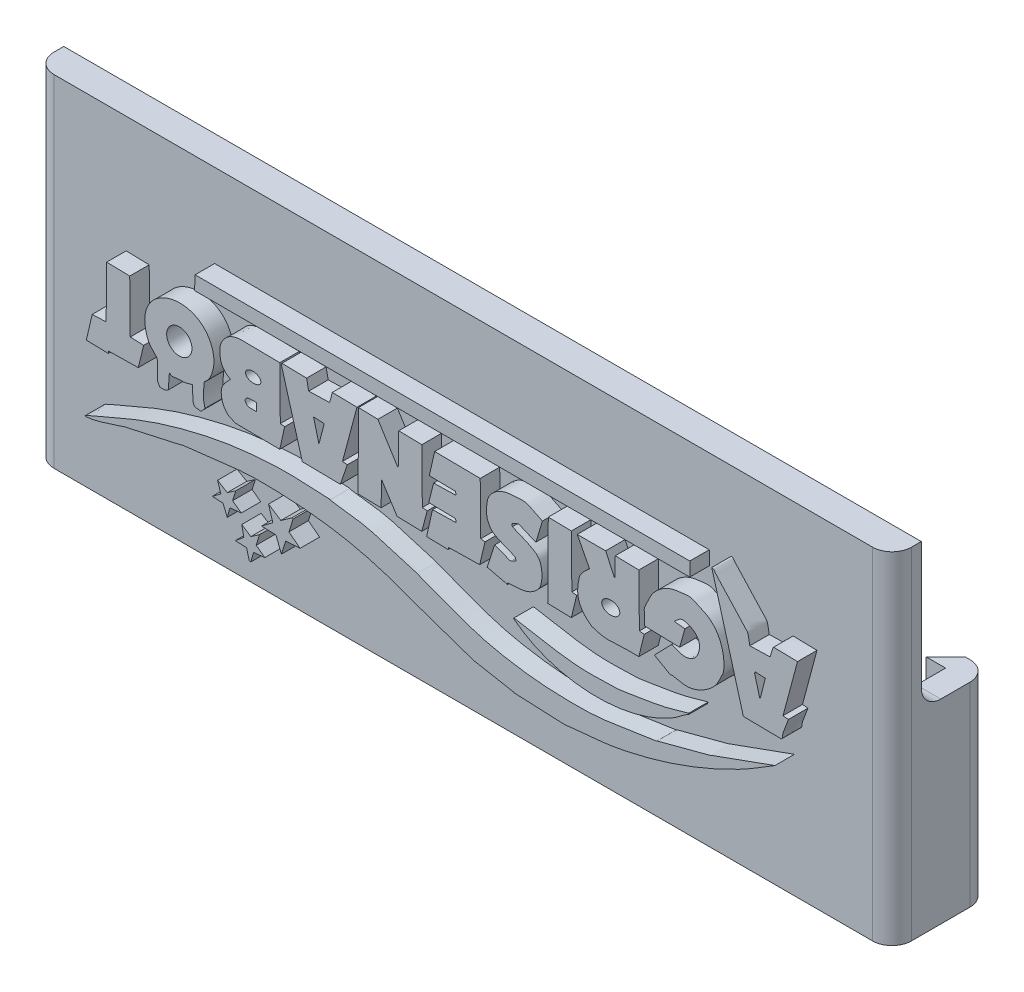
from build123d import *

# Parameters (mm, degrees)
SKETCH1_W           = 83
SKETCH1_H           = 3
BOSS_EXTRUDE2_DEPTH = 35
SKETCH2_W           = 94.753753564
SKETCH2_H           = 10.169192506
CUT_EXTRUDE1_DEPTH  = 15
FILLET1_R           = 2
SKETCH8_R           = 1.298168707
SKETCH8_RX          = 0.784396611
SKETCH8_RY          = 0.523399518
SKETCH8_RX_2        = 0.926981378
SKETCH8_RY_2        = 0.671799645
BOSS_EXTRUDE4_DEPTH = 2


with BuildPart() as part:
    # Sketch1 → Boss-Extrude2 (new body)
    with BuildSketch(Plane(origin=(0, 0, 0), x_dir=(1, 0, 0), z_dir=(0, 1, 0))):
        Rectangle(SKETCH1_W, SKETCH1_H)
        with BuildLine():
            Line((41.5, 6.5), (41.5, 1.5))
            Line((41.5, 1.5), (44, 1.5))
            Line((44, 1.5), (44, 6.5))
            ThreePointArc((44, 6.5), (43.414213562, 7.914213562), (42, 8.5))
            Line((42, 8.5), (41.5, 8.5))
            Line((41.5, 8.5), (41.5, 6.5))
        make_face()
        with BuildLine():
            Line((44, 1.5), (41.5, 1.5))
            Line((41.5, 1.5), (41.5, -1.5))
            Line((41.5, -1.5), (42, -1.5))
            ThreePointArc((42, -1.5), (43.414213562, -0.914213562), (44, 0.5))
            Line((44, 0.5), (44, 1.5))
        make_face()
        Polygon((-39.5, 6.5), (-41.5, 8.5), (-41.5, 6.5), align=None)
        with BuildLine():
            Line((-41.5, 6.5), (-41.5, 8.5))
            Line((-41.5, 8.5), (-42, 8.5))
            ThreePointArc((-42, 8.5), (-43.414213562, 7.914213562), (-44, 6.5))
            Line((-44, 6.5), (-44, 1.5))
            Line((-44, 1.5), (-41.5, 1.5))
            Line((-41.5, 1.5), (-41.5, 6.5))
        make_face()
        with BuildLine():
            Line((-41.5, -1.5), (-41.5, 1.5))
            Line((-41.5, 1.5), (-44, 1.5))
            Line((-44, 1.5), (-44, 0.5))
            ThreePointArc((-44, 0.5), (-43.414213562, -0.914213562), (-42, -1.5))
            Line((-42, -1.5), (-41.5, -1.5))
        make_face()
        Polygon((41.5, 8.5), (39.5, 6.5), (41.5, 6.5), align=None)
    extrude(amount=BOSS_EXTRUDE2_DEPTH)

    # Sketch2 → Cut-Extrude1 (cut)
    with BuildSketch(Plane(origin=(0, 35, 0), x_dir=(1, 0, 0), z_dir=(0, 1, 0))):
        with Locations((-0.425965925, 6.584596253)):
            Rectangle(SKETCH2_W, SKETCH2_H)
    extrude(amount=-CUT_EXTRUDE1_DEPTH, mode=Mode.SUBTRACT)

    # Fillet1
    fillet1_edges = [part.edges().sort_by_distance(p)[0] for p in [
        (-42.75, 20, -1.5),
        (42.75, 20, -1.5),
    ]]
    fillet(fillet1_edges, radius=FILLET1_R)

    # Sketch8 → Boss-Extrude4 (add)
    # profile 1 of 17: a face of its own
    with BuildSketch(Plane.XY.offset(1.5)):
        Polygon((-34.431752396, 15.002866554), (-36.686752396, 15.057866554), (-36.081752396, 17.642866554), (-34.651752396, 17.697866554), (-34.596752396, 23.032866554), (-32.231752396, 22.977866554), (-32.176752396, 17.587866554), (-30.801752396, 17.532866554), (-31.351752396, 15.277866554), (-34.431752396, 15.222866554), align=None)
    # profile 2 of 17: a face of its own
    with BuildSketch(Plane.XY.offset(1.5)):
        with BuildLine():
            Line((-28.161752396, 16.432866554), (-28.271752396, 14.837866554))
            add(Edge.make_bspline(
                [(-28.271752396, 14.837866554), (-28.583664674, 14.603932345), (-28.771572634, 14.60950326), (-29.151752396, 14.672866554)],
                knots=[0, 0, 0, 0, 1, 1, 1, 1], degree=3))
            add(Edge.make_bspline(
                [(-29.151752396, 14.672866554), (-29.225085729, 14.819533221), (-29.353237655, 14.949936835), (-29.371752396, 15.112866554), (-29.446301534, 15.768898975), (-29.273194866, 16.450716886), (-29.426752396, 17.092866554), (-29.429544349, 17.104541997), (-30.195335725, 17.877894322), (-30.306752396, 18.137866554), (-32.387590316, 22.993155035), (-25.406781765, 25.076942914), (-23.816752396, 20.942866554), (-23.429873816, 19.936982246), (-23.563835241, 19.002284295), (-23.981752396, 18.082866554), (-24.051576397, 17.929253752), (-24.196621251, 17.777186223), (-24.311752396, 17.642866554), (-24.404937853, 17.534150187), (-24.56969224, 17.455034514), (-24.586752396, 17.312866554), (-24.907668004, 14.63856982), (-24.066325109, 15.468293841), (-24.916752396, 14.617866554)],
                knots=[0, 0, 0, 0, 1, 1, 1, 2, 2, 2, 3, 3, 3, 4, 4, 4, 5, 5, 5, 6, 6, 6, 7, 7, 7, 8, 8, 8, 8], degree=3))
            add(Edge.make_bspline(
                [(-24.916752396, 14.617866554), (-25.490064668, 14.669985852), (-25.701630184, 14.621033386), (-25.741752396, 15.222866554), (-25.771046156, 15.662272957), (-25.778419062, 16.102866554), (-25.796752396, 16.542866554)],
                knots=[0, 0, 0, 0, 1, 1, 1, 2, 2, 2, 2], degree=3))
            add(Edge.make_bspline(
                [(-25.796752396, 16.542866554), (-26.1436054, 16.462823553), (-26.485783452, 16.322866554), (-26.841752396, 16.322866554), (-28.076528965, 16.322866554), (-27.811755157, 16.082869315), (-28.161752396, 16.432866554)],
                knots=[0, 0, 0, 0, 1, 1, 1, 2, 2, 2, 2], degree=3))
        make_face()
        with Locations((-27.142932939, 19.715520982)):
            Circle(SKETCH8_R, mode=Mode.SUBTRACT)
    # profile 3 of 17: a face of its own
    with BuildSketch(Plane.XY.offset(1.5)):
        with BuildLine():
            Line((-16.831752396, 22.977866554), (-16.776752396, 17.587866554))
            Line((-16.776752396, 17.587866554), (-16.336752396, 17.532866554))
            Line((-16.336752396, 17.532866554), (-16.831752396, 15.277866554))
            add(Edge.make_bspline(
                [(-16.831752396, 15.277866554), (-18.371752396, 15.296199887), (-19.912069423, 15.296638719), (-21.451752396, 15.332866554), (-21.47767247, 15.333476438), (-21.483562359, 15.376271536), (-21.506752396, 15.387866554), (-21.704888152, 15.486934432), (-21.932168699, 15.533167217), (-22.111752396, 15.662866554), (-22.327674819, 15.818810526), (-22.642715124, 16.271396557), (-22.716752396, 16.542866554), (-23.055803922, 17.786055485), (-22.675276976, 18.179341973), (-21.891752396, 18.962866554)],
                knots=[0, 0, 0, 0, 1, 1, 1, 2, 2, 2, 3, 3, 3, 4, 4, 4, 5, 5, 5, 5], degree=3))
            add(Edge.make_bspline(
                [(-21.891752396, 18.962866554), (-22.323426371, 19.178703542), (-22.766271196, 19.632845515), (-22.881752396, 20.117866554), (-23.129435305, 21.158134774), (-22.988642704, 21.925080678), (-22.166752396, 22.592866554), (-21.82156555, 22.873330866), (-21.216170454, 23.027813958), (-20.791752396, 23.032866554), (-19.471718623, 23.048581242), (-18.151752396, 22.996199887), (-16.831752396, 22.977866554)],
                knots=[0, 0, 0, 0, 1, 1, 1, 2, 2, 2, 3, 3, 3, 4, 4, 4, 4], degree=3))
        make_face()
        with Locations(Location((-19.556858741, 20.318238948), (0, 0, -3.094067165))):
            Ellipse(SKETCH8_RX, SKETCH8_RY, mode=Mode.SUBTRACT)
        with BuildLine():
            Line((-19.196752396, 18.247866554), (-19.196752396, 17.422866554))
            add(Edge.make_bspline(
                [(-19.196752396, 17.422866554), (-19.853114293, 17.461476077), (-20.248458466, 17.284690836), (-20.406752396, 17.917866554)],
                knots=[0, 0, 0, 0, 1, 1, 1, 1], degree=3))
            add(Edge.make_bspline(
                [(-20.406752396, 17.917866554), (-20.315085729, 18.009533221), (-20.257863339, 18.162840139), (-20.131752396, 18.192866554), (-19.828037026, 18.265179737), (-19.508419062, 18.229533221), (-19.196752396, 18.247866554)],
                knots=[0, 0, 0, 0, 1, 1, 1, 2, 2, 2, 2], degree=3))
        make_face(mode=Mode.SUBTRACT)
    # profile 4 of 17: a face of its own
    with BuildSketch(Plane.XY.offset(1.5)):
        Polygon((25.243247604, 24.957866554), (-25.576752396, 25.012866554), (-25.521752396, 26.442866554), (25.243247604, 26.387866554), align=None)
    # profile 5 of 17: a face of its own
    with BuildSketch(Plane.XY.offset(1.5)):
        Polygon((-10.616752396, 15.277866554), (-14.521752396, 15.332866554), (-16.666752396, 22.867866554), (-16.611752396, 23.032866554), (-14.081752396, 22.977866554), (-13.861752396, 21.932866554), (-11.716752396, 21.987866554), (-11.441752396, 23.032866554), (-8.911752396, 22.977866554), (-10.396752396, 17.422866554), (-9.901752396, 17.367866554), align=None)
        Polygon((-12.816752396, 17.752866554), (-13.366752396, 19.897866554), (-12.266752396, 19.842866554), align=None, mode=Mode.SUBTRACT)
    # profile 6 of 17: a face of its own
    with BuildSketch(Plane.XY.offset(1.5)):
        Polygon((-2.256752396, 15.277866554), (-4.786752396, 15.332866554), (-6.381752396, 17.807866554), (-6.436752396, 15.277866554), (-8.801752396, 15.332866554), (-8.746752396, 23.032866554), (-6.766752396, 22.977866554), (-4.676752396, 19.677866554), (-4.621752396, 23.032866554), (-2.256752396, 22.977866554), (-2.201752396, 17.422866554), (-1.706752396, 17.367866554), align=None)
    # profile 7 of 17: a face of its own
    with BuildSketch(Plane.XY.offset(1.5)):
        Polygon((0.438247604, 15.002866554), (-1.761752396, 15.057866554), (-1.156752396, 17.752866554), (1.263247604, 17.807866554), (1.208247604, 18.137866554), (-1.541752396, 18.192866554), (-1.046752396, 20.172866554), (1.263247604, 20.227866554), (1.208247604, 20.557866554), (-1.486752396, 20.612866554), (-0.936752396, 23.032866554), (3.738247604, 22.977866554), (3.793247604, 17.642866554), (4.233247604, 17.587866554), (3.683247604, 15.277866554), (0.493247604, 15.222866554), align=None)
    # profile 8 of 17: a face of its own
    with BuildSketch(Plane.XY.offset(1.5)):
        with BuildLine():
            Line((6.543247604, 14.947866554), (4.453247604, 15.442866554))
            Line((4.453247604, 15.442866554), (5.223247604, 17.807866554))
            add(Edge.make_bspline(
                [(5.223247604, 17.807866554), (7.139761626, 17.208955922), (6.433492103, 16.982988803), (7.423247604, 17.477866554)],
                knots=[0, 0, 0, 0, 1, 1, 1, 1], degree=3))
            add(Edge.make_bspline(
                [(7.423247604, 17.477866554), (7.368247604, 17.587866554), (7.365507016, 17.74769664), (7.258247604, 17.807866554), (6.592624427, 18.181264922), (5.805224957, 18.322461501), (5.168247604, 18.742866554), (4.862224155, 18.94484203), (4.635006236, 19.278807411), (4.508247604, 19.622866554), (4.36823812, 20.002892298), (4.368692721, 20.428949816), (4.398247604, 20.832866554), (4.424532907, 21.19209903), (4.481563219, 21.572914123), (4.673247604, 21.877866554), (4.901014884, 22.24022359), (5.232853931, 22.552293828), (5.608247604, 22.757866554), (6.025711235, 22.98647759), (6.508340767, 23.111206098), (6.983247604, 23.142866554), (8.420461879, 23.238680839), (8.365868637, 23.249056037), (9.018247604, 22.922866554), (9.384914271, 22.739533221), (9.751580938, 22.556199887), (10.118247604, 22.372866554)],
                knots=[0, 0, 0, 0, 1, 1, 1, 2, 2, 2, 3, 3, 3, 4, 4, 4, 5, 5, 5, 6, 6, 6, 7, 7, 7, 8, 8, 8, 9, 9, 9, 9], degree=3))
            Line((10.118247604, 22.372866554), (9.458247604, 20.172866554))
            add(Edge.make_bspline(
                [(9.458247604, 20.172866554), (7.306951078, 20.889965396), (8.11398729, 21.115417526), (6.983247604, 20.612866554)],
                knots=[0, 0, 0, 0, 1, 1, 1, 1], degree=3))
            Line((6.983247604, 20.612866554), (7.038247604, 20.337866554))
            add(Edge.make_bspline(
                [(7.038247604, 20.337866554), (7.844914271, 19.952866554), (8.733636357, 19.7061969), (9.458247604, 19.182866554), (9.764284233, 18.9618401), (9.937249111, 18.563636463), (10.008247604, 18.192866554), (10.108298792, 17.670377018), (10.093221503, 17.111104182), (9.953247604, 16.597866554), (9.863519382, 16.268863073), (9.610967254, 15.990289713), (9.348247604, 15.772866554), (9.064009683, 15.53763517), (8.717391053, 15.362370895), (8.358247604, 15.277866554), (7.766901682, 15.138726337), (7.148247604, 15.167866554), (6.543247604, 15.112866554)],
                knots=[0, 0, 0, 0, 1, 1, 1, 2, 2, 2, 3, 3, 3, 4, 4, 4, 5, 5, 5, 6, 6, 6, 6], degree=3))
            Line((6.543247604, 15.112866554), (6.543247604, 14.947866554))
        make_face()
    # profile 9 of 17: a face of its own
    with BuildSketch(Plane.XY.offset(1.5)):
        Polygon((13.088247604, 15.277866554), (10.668247604, 15.332866554), (10.723247604, 23.032866554), (13.088247604, 22.977866554), (13.143247604, 17.587866554), (13.638247604, 17.532866554), align=None)
    # profile 10 of 17: a face of its own
    with BuildSketch(Plane.XY.offset(1.5)):
        with BuildLine():
            Line((14.958247604, 20.557866554), (13.693247604, 22.977866554))
            Line((13.693247604, 22.977866554), (16.608247604, 22.977866554))
            Line((16.608247604, 22.977866554), (17.543247604, 20.997866554))
            Line((17.543247604, 20.997866554), (17.598247604, 23.032866554))
            Line((17.598247604, 23.032866554), (20.018247604, 22.977866554))
            Line((20.018247604, 22.977866554), (20.073247604, 17.587866554))
            Line((20.073247604, 17.587866554), (20.568247604, 17.532866554))
            Line((20.568247604, 17.532866554), (20.018247604, 15.277866554))
            add(Edge.make_bspline(
                [(20.018247604, 15.277866554), (16.688386224, 15.32168052), (16.972274409, 14.954857619), (15.178247604, 15.552866554), (15.153650857, 15.56106547), (15.144488034, 15.592998253), (15.123247604, 15.607866554), (13.756455048, 16.564621343), (13.509215215, 17.676736995), (13.913247604, 19.292866554), (14.039895182, 19.799456865), (14.625366058, 20.224985007), (14.958247604, 20.557866554)],
                knots=[0, 0, 0, 0, 1, 1, 1, 2, 2, 2, 3, 3, 3, 4, 4, 4, 4], degree=3))
        make_face()
        with Locations(Location((17.13632191, 18.186672345), (0, 0, -178.888274887))):
            Ellipse(SKETCH8_RX_2, SKETCH8_RY_2, mode=Mode.SUBTRACT)
    # profile 11 of 17: a face of its own
    with BuildSketch(Plane.XY.offset(1.5)):
        with BuildLine():
            Line((23.263247604, 15.277866554), (21.613247604, 16.212866554))
            Line((21.613247604, 16.212866554), (23.373247604, 18.027866554))
            add(Edge.make_bspline(
                [(23.373247604, 18.027866554), (23.831580938, 17.899533221), (24.27242144, 17.654195748), (24.748247604, 17.642866554), (25.078662829, 17.634999525), (25.426131146, 17.765195569), (25.683247604, 17.972866554), (25.932735172, 18.174375743), (26.104794151, 18.485689376), (26.178247604, 18.797866554), (26.258140064, 19.137409507), (26.2712967, 19.527028483), (26.123247604, 19.842866554), (25.974586311, 20.160010647), (25.67016745, 20.408727803), (25.353247604, 20.557866554), (24.361696745, 21.024478723), (24.250101096, 20.762847435), (23.648247604, 20.227866554)],
                knots=[0, 0, 0, 0, 1, 1, 1, 2, 2, 2, 3, 3, 3, 4, 4, 4, 5, 5, 5, 6, 6, 6, 6], degree=3))
            Line((23.648247604, 20.227866554), (24.748247604, 20.117866554))
            Line((24.748247604, 20.117866554), (24.198247604, 18.192866554))
            Line((24.198247604, 18.192866554), (20.623247604, 18.302866554))
            add(Edge.make_bspline(
                [(20.623247604, 18.302866554), (20.668434738, 19.794041971), (20.408307891, 19.601197106), (20.733247604, 20.227866554), (20.971045964, 20.686477677), (21.133733787, 21.193045519), (21.448247604, 21.602866554), (21.748577636, 21.994205686), (22.125246731, 22.33906603), (22.548247604, 22.592866554), (22.965957084, 22.843492242), (23.440536069, 23.022414142), (23.923247604, 23.087866554), (25.064583421, 23.242623953), (25.286075106, 23.297881923), (25.903247604, 22.977866554), (26.361858727, 22.740068194), (26.872038091, 22.582031172), (27.278247604, 22.262866554), (27.656646143, 21.965553417), (27.987688352, 21.58795899), (28.213247604, 21.162866554), (28.474173087, 20.671122376), (28.641545921, 20.120537641), (28.708247604, 19.567866554), (28.769538748, 19.060025648), (28.823187733, 18.362759641), (28.543247604, 17.862866554), (28.306587199, 17.440258688), (28.148425004, 16.961311169), (27.828247604, 16.597866554), (27.457282758, 16.176771323), (26.999760754, 15.823700331), (26.508247604, 15.552866554), (26.086769559, 15.32062355), (25.61217961, 15.159820672), (25.133247604, 15.112866554), (24.655707846, 15.066048931), (24.178254329, 15.21000845), (23.703247604, 15.277866554), (23.534450162, 15.301980474), (23.440939003, 15.366712254), (23.263247604, 15.277866554)],
                knots=[0, 0, 0, 0, 1, 1, 1, 2, 2, 2, 3, 3, 3, 4, 4, 4, 5, 5, 5, 6, 6, 6, 7, 7, 7, 8, 8, 8, 9, 9, 9, 10, 10, 10, 11, 11, 11, 12, 12, 12, 13, 13, 13, 14, 14, 14, 14], degree=3))
        make_face()
    # profile 12 of 17: a face of its own
    with BuildSketch(Plane.XY.offset(1.5)):
        with BuildLine():
            Line((30.743247604, 15.332866554), (27.498247604, 26.937866554))
            add(Edge.make_bspline(
                [(27.498247604, 26.937866554), (27.553247604, 26.919533221), (27.619616902, 26.921043418), (27.663247604, 26.882866554), (27.771007489, 26.788576655), (27.843118734, 26.659886533), (27.938247604, 26.552866554), (28.1365237, 26.329805947), (28.342015254, 26.11326389), (28.543247604, 25.892866554), (29.129486108, 25.250795812), (29.715740306, 24.608783607), (30.303247604, 23.967866554), (30.504914271, 23.747866554), (30.709971509, 23.530927161), (30.908247604, 23.307866554), (31.003376474, 23.200846575), (31.134747071, 23.112590257), (31.183247604, 22.977866554), (31.303821216, 22.642939856), (31.329914271, 22.281199887), (31.403247604, 21.932866554)],
                knots=[0, 0, 0, 0, 1, 1, 1, 2, 2, 2, 3, 3, 3, 4, 4, 4, 5, 5, 5, 6, 6, 6, 7, 7, 7, 7], degree=3))
            Line((31.403247604, 21.932866554), (33.493247604, 21.987866554))
            add(Edge.make_bspline(
                [(33.493247604, 21.987866554), (33.584914271, 22.299533221), (33.655939171, 22.618029377), (33.768247604, 22.922866554), (33.786173982, 22.971523865), (33.826405356, 23.031739549), (33.878247604, 23.032866554), (34.684931985, 23.050403171), (35.491580938, 22.996199887), (36.298247604, 22.977866554)],
                knots=[0, 0, 0, 0, 1, 1, 1, 2, 2, 2, 3, 3, 3, 3], degree=3))
            Line((36.298247604, 22.977866554), (34.813247604, 17.422866554))
            Line((34.813247604, 17.422866554), (35.363247604, 17.367866554))
            add(Edge.make_bspline(
                [(35.363247604, 17.367866554), (35.198154541, 16.872587364), (34.987494017, 16.362044189), (34.813247604, 15.882866554), (34.739914271, 15.681199887), (34.807833769, 15.277866554), (34.593247604, 15.277866554), (33.309783325, 15.277866554), (32.026580938, 15.314533221), (30.743247604, 15.332866554)],
                knots=[0, 0, 0, 0, 1, 1, 1, 2, 2, 2, 3, 3, 3, 3], degree=3))
        make_face()
        Polygon((32.448247604, 17.697866554), (31.898247604, 19.732866554), (31.953247604, 19.897866554), (32.998247604, 19.842866554), align=None, mode=Mode.SUBTRACT)
    # profile 13 of 17: a face of its own
    with BuildSketch(Plane.XY.offset(1.5)):
        with BuildLine():
            Line((7.148247604, 12.252866554), (7.203247604, 12.307866554))
            add(Edge.make_bspline(
                [(7.203247604, 12.307866554), (9.720872883, 11.920539588), (12.150659826, 11.290992508), (14.738247604, 11.262866554), (15.74668802, 11.251905245), (16.755390179, 11.281871646), (17.763247604, 11.317866554), (18.133989592, 11.331107339), (18.897076568, 11.470171381), (19.303247604, 11.537866554), (20.398601218, 11.72042549), (21.426966239, 11.85937769), (22.493247604, 12.087866554), (23.269911331, 12.254294495), (24.303940549, 12.59553979), (25.133247604, 12.802866554)],
                knots=[0, 0, 0, 0, 1, 1, 1, 2, 2, 2, 3, 3, 3, 4, 4, 4, 5, 5, 5, 5], degree=3))
            Line((25.133247604, 12.802866554), (25.078247604, 12.637866554))
            add(Edge.make_bspline(
                [(25.078247604, 12.637866554), (24.708504505, 12.514618854), (24.034881736, 11.905531857), (23.703247604, 11.702866554), (22.865044367, 11.190631242), (21.995412001, 10.776835425), (21.063247604, 10.437866554), (16.706286753, 8.853517154), (10.869883115, 9.275558146), (7.148247604, 12.252866554)],
                knots=[0, 0, 0, 0, 1, 1, 1, 2, 2, 2, 3, 3, 3, 3], degree=3))
        make_face()
    # profile 14 of 17: a face of its own
    with BuildSketch(Plane.XY.offset(1.5)):
        Polygon((-16.666752396, 6.037866554), (-17.216752396, 7.467866554), (-18.701752396, 7.522866554), (-17.546752396, 8.402866554), (-17.986752396, 9.832866554), (-16.721752396, 9.007866554), (-15.566752396, 9.832866554), (-15.456752396, 9.777866554), (-15.896752396, 8.402866554), (-14.741752396, 7.522866554), (-16.226752396, 7.412866554), align=None)
    # profile 15 of 17: a face of its own
    with BuildSketch(Plane.XY.offset(1.5)):
        Polygon((-19.801752396, 3.782866554), (-19.966752396, 3.837866554), (-20.241752396, 4.827866554), (-21.396752396, 4.882866554), (-20.516752396, 5.597866554), (-20.736752396, 6.642866554), (-19.801752396, 6.037866554), (-18.921752396, 6.642866554), (-19.251752396, 5.542866554), (-18.371752396, 4.882866554), (-19.526752396, 4.772866554), align=None)
    # profile 16 of 17: a face of its own
    with BuildSketch(Plane.XY.offset(1.5)):
        Polygon((-22.221752396, 6.532866554), (-22.661752396, 7.577866554), (-23.761752396, 7.632866554), (-22.881752396, 8.292866554), (-23.211752396, 9.337866554), (-22.221752396, 8.732866554), (-21.341752396, 9.337866554), (-21.671752396, 8.292866554), (-20.791752396, 7.632866554), (-21.946752396, 7.522866554), align=None)
    # profile 17 of 17: a face of its own
    with BuildSketch(Plane.XY.offset(1.5)):
        with BuildLine():
            add(Edge.make_bspline(
                [(-36.686752396, 8.237866554), (-37.29965972, 8.188171366), (-35.600114667, 8.81639556), (-35.036752396, 9.062866554), (-33.545762822, 9.715174493), (-32.059169056, 10.384911506), (-30.526752396, 10.932866554), (-29.030346703, 11.467944953), (-27.504045707, 11.924630034), (-25.961752396, 12.307866554), (-24.475272324, 12.677234329), (-22.969113203, 12.978888718), (-21.451752396, 13.187866554), (-19.902765302, 13.401200106), (-18.339961992, 13.537539783), (-16.776752396, 13.572866554), (-15.08961999, 13.61099384), (-13.402789737, 13.479612824), (-11.716752396, 13.407866554), (-11.675794882, 13.406123681), (-11.64717596, 13.359684987), (-11.606752396, 13.352866554), (-10.085085729, 13.096199887), (-8.518280801, 13.031432146), (-7.041752396, 12.582866554), (-5.632071223, 12.154608983), (-4.216433568, 11.746124125), (-2.806752396, 11.317866554), (-2.767527944, 11.305950265), (-2.735259242, 11.276929924), (-2.696752396, 11.262866554), (-0.626673638, 10.50683779), (1.405015442, 9.633210765), (3.518247604, 9.007866554), (5.007660176, 8.567122017), (6.5454129, 8.291201111), (8.083247604, 8.072866554), (9.521330744, 7.868694256), (10.975995158, 7.769927159), (12.428247604, 7.742866554), (13.969725063, 7.714143372), (15.525230452, 7.723290822), (17.048247604, 7.962866554), (18.641365922, 8.213469435), (20.240129287, 8.427263673), (21.833247604, 8.677866554), (21.873744214, 8.684236807), (21.903670245, 8.722180667), (21.943247604, 8.732866554), (23.7378092, 9.217398185), (25.538686009, 9.678334923), (27.333247604, 10.162866554), (27.372824964, 10.173552441), (27.404721168, 10.203856941), (27.443247604, 10.217866554), (29.623312904, 11.010617572), (31.806580938, 11.794533221), (33.988247604, 12.582866554)],
                knots=[20, 20, 20, 20, 21, 21, 21, 22, 22, 22, 23, 23, 23, 24, 24, 24, 25, 25, 25, 26, 26, 26, 27, 27, 27, 28, 28, 28, 29, 29, 29, 30, 30, 30, 31, 31, 31, 32, 32, 32, 33, 33, 33, 34, 34, 34, 35, 35, 35, 36, 36, 36, 37, 37, 37, 38, 38, 38, 39, 39, 39, 39], degree=3))
            add(Edge.make_bspline(
                [(33.988247604, 12.582866554), (32.814914271, 11.886199887), (31.676346968, 11.127336004), (30.468247604, 10.492866554), (29.124885605, 9.787359892), (27.748925901, 9.139206765), (26.343247604, 8.567866554), (24.903707344, 7.982763093), (23.435614405, 7.460837169), (21.943247604, 7.027866554), (20.461199348, 6.597889591), (18.954658438, 6.241045362), (17.433247604, 5.982866554), (15.924234656, 5.726791629), (14.389675223, 5.655056402), (12.868247604, 5.487866554), (12.721323996, 5.471721103), (12.575991774, 5.428521137), (12.428247604, 5.432866554), (10.70410027, 5.48357677), (8.980805729, 5.563149985), (7.258247604, 5.652866554), (7.217308514, 5.654998798), (7.188504546, 5.700124834), (7.148247604, 5.707866554), (5.75696398, 5.975421097), (4.359531228, 6.210312011), (2.968247604, 6.477866554), (2.927990663, 6.485608274), (2.897002772, 6.519502703), (2.858247604, 6.532866554), (1.263247604, 7.082866554), (-0.335127569, 7.623174307), (-1.926752396, 8.182866554), (-3.55672394, 8.756043361), (-5.162283867, 9.406718874), (-6.821752396, 9.887866554), (-8.265620387, 10.306502835), (-9.736815404, 10.643402819), (-11.221752396, 10.877866554), (-12.877710158, 11.139333569), (-14.551779399, 11.301968226), (-16.226752396, 11.372866554), (-18.058811877, 11.450414045), (-19.90750863, 11.492665766), (-21.726752396, 11.262866554), (-23.430102221, 11.047706576), (-25.13840257, 10.873026532), (-26.841752396, 10.657866554), (-26.882423789, 10.652729115), (-26.911777234, 10.611951818), (-26.951752396, 10.602866554), (-28.929614153, 10.153352518), (-30.913890638, 9.73238059), (-32.891752396, 9.282866554), (-32.931727557, 9.27378129), (-32.962228864, 9.238749845), (-33.001752396, 9.227866554), (-34.228001404, 8.890203784), (-35.419023233, 8.340655405), (-36.686752396, 8.237866554)],
                knots=[0, 0, 0, 0, 1, 1, 1, 2, 2, 2, 3, 3, 3, 4, 4, 4, 5, 5, 5, 6, 6, 6, 7, 7, 7, 8, 8, 8, 9, 9, 9, 10, 10, 10, 11, 11, 11, 12, 12, 12, 13, 13, 13, 14, 14, 14, 15, 15, 15, 16, 16, 16, 17, 17, 17, 18, 18, 18, 19, 19, 19, 20, 20, 20, 20], degree=3))
        make_face()
    extrude(amount=BOSS_EXTRUDE4_DEPTH)


solid = part.part
